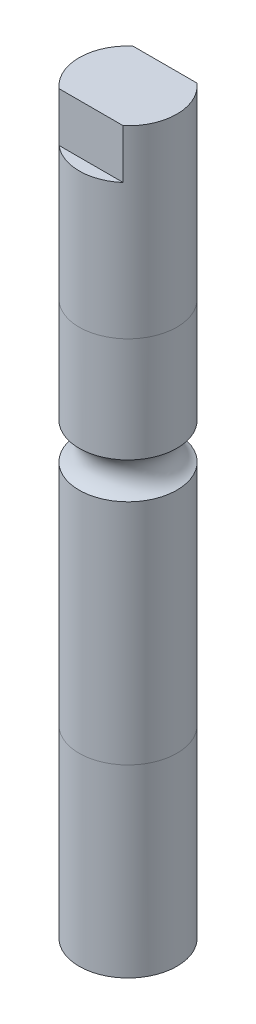
from build123d import *

# Parameters (mm, degrees)
CROQUIS1_R              = 3.975
SALIENTE_EXTRUIR1_DEPTH = 60
CORTAR_EXTRUIR1_START   = -4
CORTAR_EXTRUIR1_DEPTH   = 4


with BuildPart() as part:
    # Croquis1 → Saliente-Extruir1 (new body)
    with BuildSketch(Plane(origin=(0, 0, 0), x_dir=(1, 0, 0), z_dir=(0, 1, 0))):
        with Locations(Location((0, 0, 0), (0, 0, 270))):
            Circle(CROQUIS1_R)
    extrude(amount=SALIENTE_EXTRUIR1_DEPTH)

    # Croquis2 → Cortar-Revolución1 (revolve, cut)
    with BuildSketch(Plane.XY, mode=Mode.PRIVATE) as cortar_revoluci_n1_sk:
        with BuildLine():
            Line((3.975, 33.527120168), (3.975, 36.472879832))
            ThreePointArc((3.975, 36.472879832), (3, 35), (3.975, 33.527120168))
        make_face()
    revolve(cortar_revoluci_n1_sk.sketch.rotate(Axis((0, 0, 0), (0, 1, 0)), 90), axis=Axis((0, 0, 0), (0, 1, 0)), mode=Mode.SUBTRACT)

    # Croquis3 → Cortar-Extruir1 (cut)
    with BuildSketch(Plane(origin=(0, 60, 0), x_dir=(1, 0, 0), z_dir=(0, 1, 0)).offset(CORTAR_EXTRUIR1_START)):
        with BuildLine():
            Line((-2.607800798, 3), (2.607800798, 3))
            ThreePointArc((2.607800798, 3), (0, 3.975), (-2.607800798, 3))
        make_face()
        with BuildLine():
            Line((-2.607800798, -3), (2.607800798, -3))
            ThreePointArc((2.607800798, -3), (0, -3.975), (-2.607800798, -3))
        make_face()
    extrude(amount=CORTAR_EXTRUIR1_DEPTH, mode=Mode.SUBTRACT)


solid = part.part
